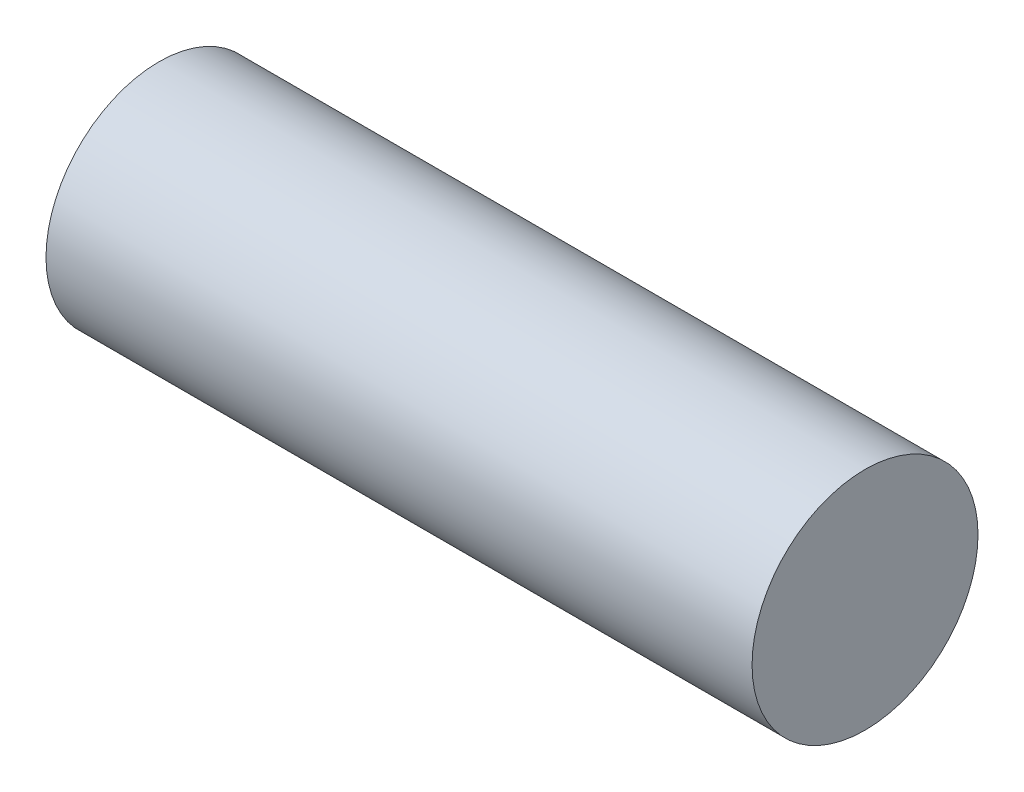
from build123d import *

# Parameters (mm, degrees)
SKETCH1_R           = 4
BOSS_EXTRUDE1_DEPTH = 25


with BuildPart() as part:
    # Sketch1 → Boss-Extrude1 (new body)
    with BuildSketch(Plane.YZ):
        with Locations(Location((0, 0, 0), (0, 0, 270))):
            Circle(SKETCH1_R)
    extrude(amount=BOSS_EXTRUDE1_DEPTH)


solid = part.part
